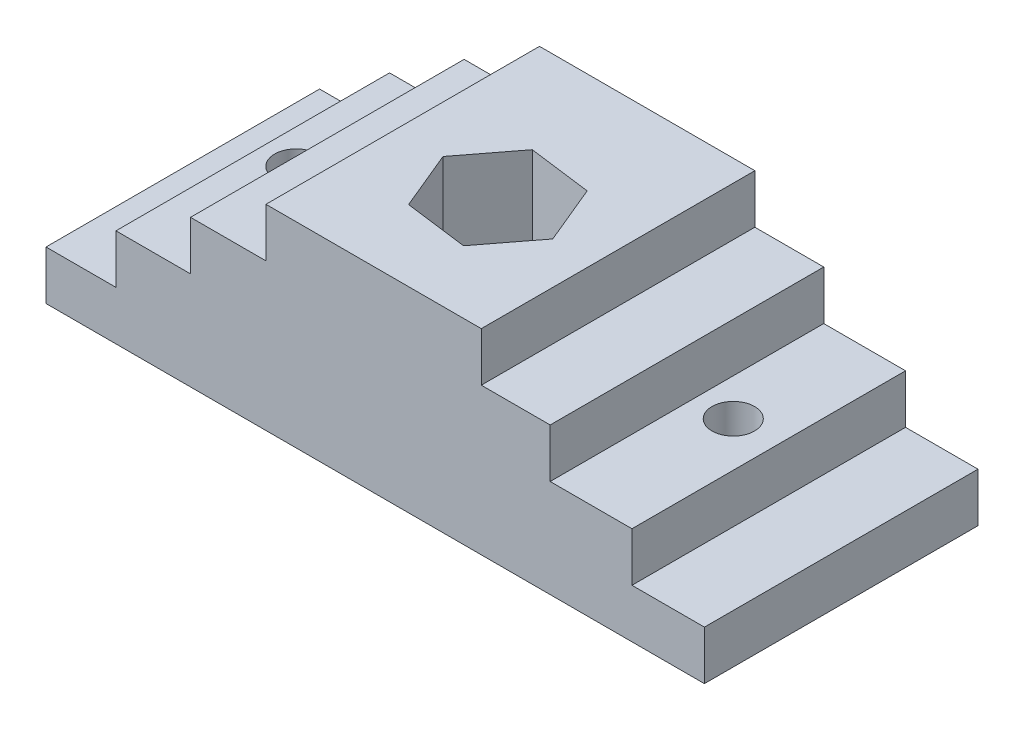
from build123d import *

# Parameters (mm, degrees)
SKETCH1_W           = 268.862640616
SKETCH1_H           = 111.719179434
BOSS_EXTRUDE1_DEPTH = 20
SKETCH2_W           = 210.712226585
SKETCH2_H           = 111.719179434
BOSS_EXTRUDE2_DEPTH = 20
SKETCH3_W           = 146.860036711
SKETCH3_H           = 111.719179434
BOSS_EXTRUDE3_DEPTH = 20
SKETCH5_W           = 87.947337462
SKETCH5_H           = 111.719179434
BOSS_EXTRUDE5_DEPTH = 20
SKETCH9_R           = 8.750978852
SKETCH9_R_2         = 8.685098526
CUT_EXTRUDE3_DEPTH  = 163.837867161
CUT_EXTRUDE4_DEPTH  = 177.963756124


with BuildPart() as part:
    # Sketch1 → Boss-Extrude1 (new body)
    with BuildSketch(Plane(origin=(0, 0, 0), x_dir=(1, 0, 0), z_dir=(0, 1, 0))):
        with Locations((12.89067455, -0.818455527)):
            Rectangle(SKETCH1_W, SKETCH1_H)
    extrude(amount=BOSS_EXTRUDE1_DEPTH)

    # Sketch2 → Boss-Extrude2 (add)
    with BuildSketch(Plane(origin=(0, 20, 0), x_dir=(1, 0, 0), z_dir=(0, 1, 0))):
        with Locations((12.379125057, -0.818455527)):
            Rectangle(SKETCH2_W, SKETCH2_H)
    extrude(amount=BOSS_EXTRUDE2_DEPTH)

    # Sketch3 → Boss-Extrude3 (add)
    with BuildSketch(Plane(origin=(0, 40, 0), x_dir=(1, 0, 0), z_dir=(0, 1, 0))):
        with Locations((10.905612982, -0.818455527)):
            Rectangle(SKETCH3_W, SKETCH3_H)
    extrude(amount=BOSS_EXTRUDE3_DEPTH)

    # Sketch5 → Boss-Extrude5 (add)
    with BuildSketch(Plane(origin=(0, 60, 0), x_dir=(1, 0, 0), z_dir=(0, 1, 0))):
        with Locations((12.234351136, -0.818455527)):
            Rectangle(SKETCH5_W, SKETCH5_H)
    extrude(amount=BOSS_EXTRUDE5_DEPTH)

    # Sketch9 → Cut-Extrude3 (cut, through all)
    with BuildSketch(Plane(origin=(0, 40, 0), x_dir=(1, 0, 0), z_dir=(0, 1, 0))):
        with Locations(Location((-78.994603396, 2.900710485, 0), (0, 0, 270))):
            Circle(SKETCH9_R)
        with Locations(Location((99.525365185, 2.900710485, 0), (0, 0, 270))):
            Circle(SKETCH9_R_2)
    extrude(amount=-CUT_EXTRUDE3_DEPTH, mode=Mode.SUBTRACT)

    # Sketch10 → Cut-Extrude4 (cut, through all)
    with BuildSketch(Plane(origin=(0, 80, 0), x_dir=(1, 0, 0), z_dir=(0, 1, 0))):
        Polygon((23.264076608, -31.015956355), (39.082685924, -10.377494547), (29.11855836, 13.641053878), (3.335821481, 17.021140493), (-12.482787835, -3.617321315), (-2.518660272, -27.63586974), align=None)
    extrude(amount=-CUT_EXTRUDE4_DEPTH, mode=Mode.SUBTRACT)


solid = part.part
